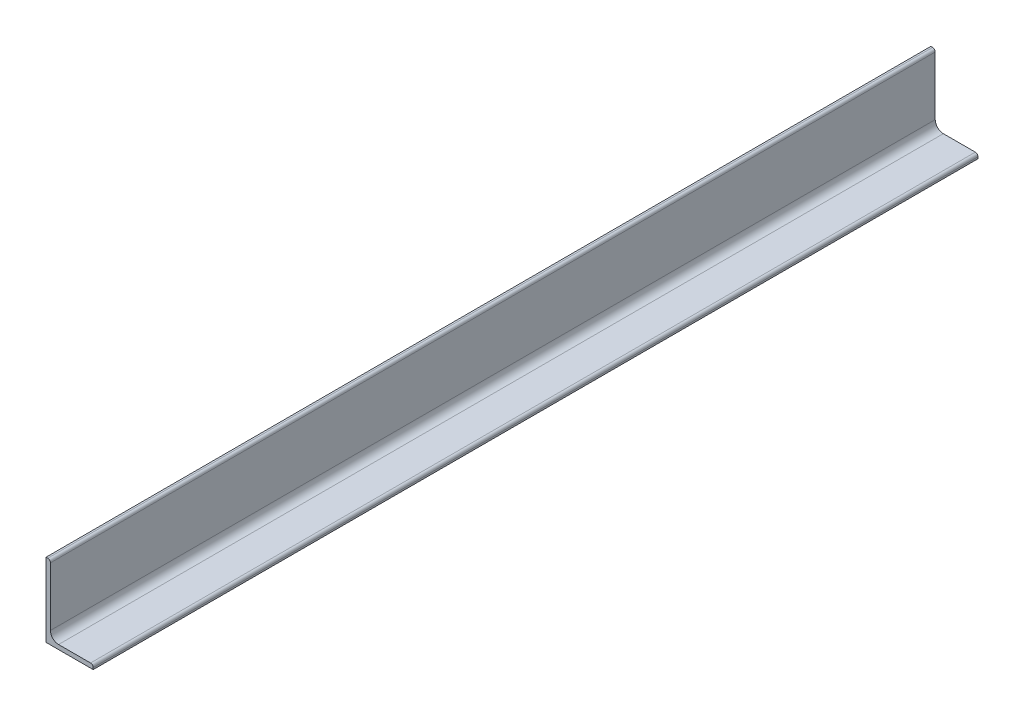
from build123d import *

# Parameters (mm, degrees)
EXTRUDE_1_DEPTH = 600


with BuildPart() as part:
    # 草图1 → 拉伸1 (new body)
    with BuildSketch(Plane.XY):
        with BuildLine():
            Line((0, 0), (0, 50))
            Line((0, 50), (1.2, 50))
            ThreePointArc((1.2, 50), (2.472792206, 49.472792206), (3, 48.2))
            Line((3, 48.2), (3, 8.5))
            ThreePointArc((3, 8.5), (4.610912703, 4.610912703), (8.5, 3))
            Line((8.5, 3), (30.2, 3))
            ThreePointArc((30.2, 3), (31.472792206, 2.472792206), (32, 1.2))
            Line((32, 1.2), (32, 0))
            Line((32, 0), (0, 0))
        make_face()
    extrude(amount=EXTRUDE_1_DEPTH)


solid = part.part
